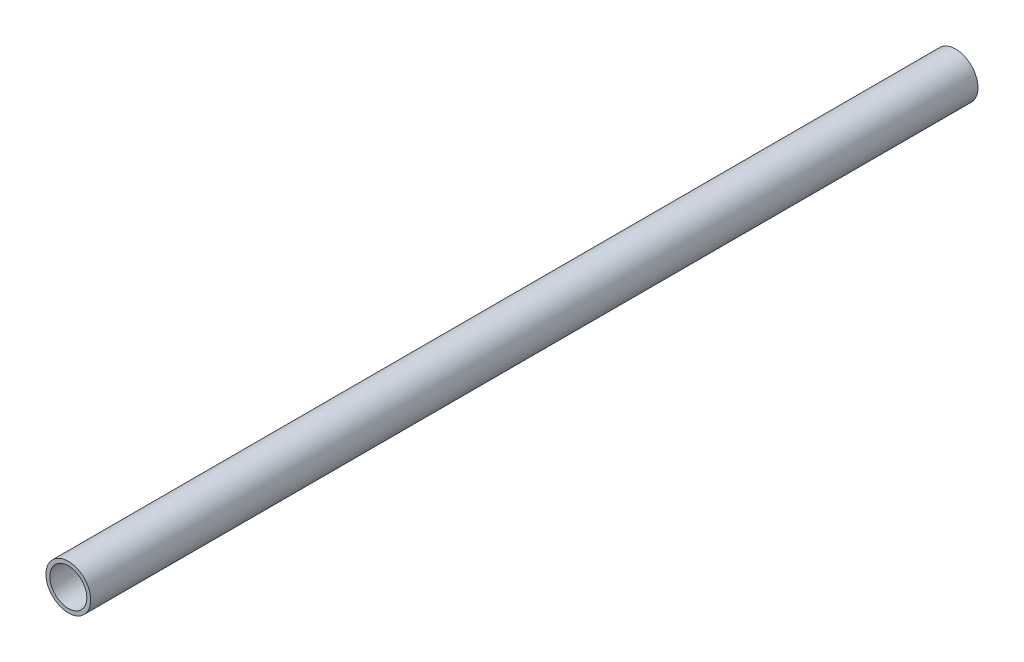
from build123d import *

# Parameters (mm, degrees)
SKETCH3_R           = 9.525
SKETCH3_R_2         = 7.874
BOSS_EXTRUDE1_DEPTH = 188.9125


with BuildPart() as part:
    # Sketch3 → Boss-Extrude1 (new, symmetric)
    with BuildSketch(Plane.XY):
        Circle(SKETCH3_R)
        Circle(SKETCH3_R_2, mode=Mode.SUBTRACT)
    extrude(amount=BOSS_EXTRUDE1_DEPTH, both=True)


solid = part.part
